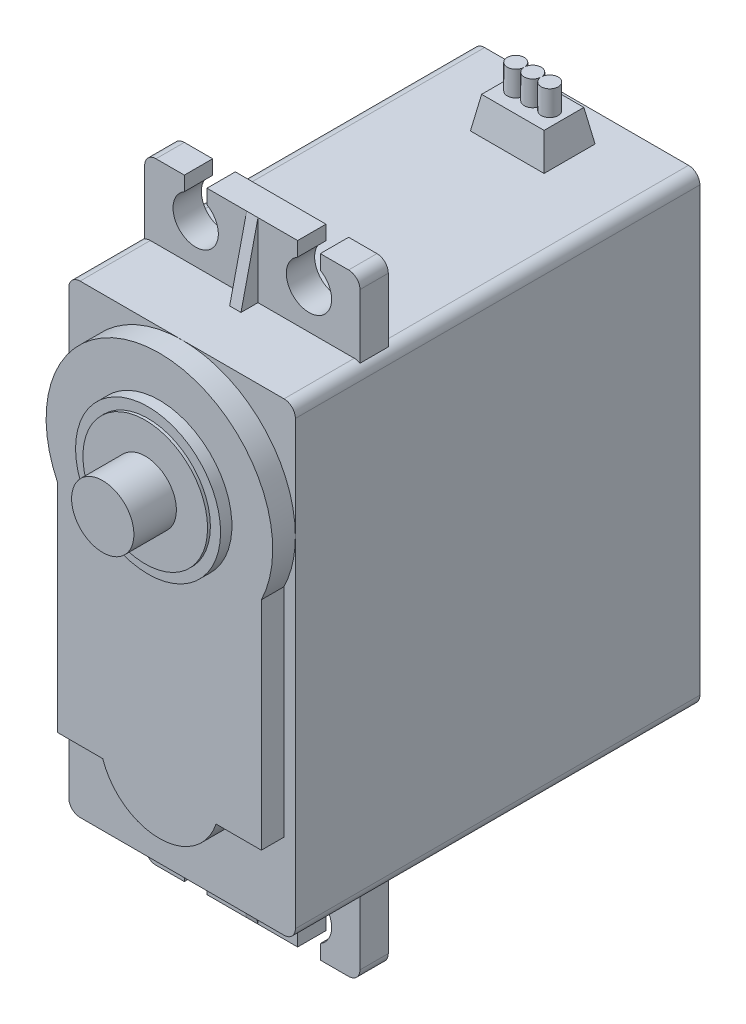
from build123d import *

# Parameters (mm, degrees)
ESQUISSE1_W              = 20
ESQUISSE1_H              = 41
BOSS_EXTRU_1_DEPTH       = 37.7
CONG_1_R                 = 1
BOSS_EXTRU_2_DEPTH       = 6.5
BOSS_EXTRU_2_DEPTH_BACK  = 47.5
ESQUISSE2_W              = 19
ESQUISSE2_H              = 2.5
ESQUISSE3_R              = 6.4
BOSS_EXTRU_3_DEPTH       = 1
ESQUISSE4_R              = 2.75
BOSS_EXTRU_4_DEPTH       = 4
ENL_V_MAT_EXTRU_1_DEPTH  = 4
ESQUISSE6_W              = 6.5
ESQUISSE6_H              = 4.5
BOSS_EXTRU_6_DEPTH       = 2.8
BOSS_EXTRU_6_TAPER       = 10
BOSS_EXTRU_12_DEPTH      = 2.2
BOSS_EXTRU_13_DEPTH      = 0.5
BOSS_EXTRU_13_DEPTH_BACK = 0.5
ESQUISSE8_W              = 34.833277075
ESQUISSE8_H              = 46.278938305
ENL_V_MAT_EXTRU_2_DEPTH  = 2
CONG_2_R                 = 1
ESQUISSE9_R              = 5.5
BOSS_EXTRU_14_DEPTH      = 0.25


with BuildPart() as part:
    # Esquisse1 → Boss.-Extru.1 (new body)
    with BuildSketch(Plane.XY):
        with Locations((10, 20.5)):
            Rectangle(ESQUISSE1_W, ESQUISSE1_H)
    extrude(amount=BOSS_EXTRU_1_DEPTH)

    # Congé1
    cong_1_edges = [part.edges().sort_by_distance(p)[0] for p in [
        (0, 41, 18.85),
        (20, 41, 18.85),
        (20, 0, 18.85),
        (0, 0, 18.85),
    ]]
    fillet(cong_1_edges, radius=CONG_1_R)

    # Esquisse2 → Boss.-Extru.2 (add, two sides: drawn at the far end of the back side and taken through both)
    with BuildSketch(Plane.XZ.offset(-BOSS_EXTRU_2_DEPTH_BACK)):
        with Locations((10, 28.25)):
            Rectangle(ESQUISSE2_W, ESQUISSE2_H)
    extrude(amount=BOSS_EXTRU_2_DEPTH + BOSS_EXTRU_2_DEPTH_BACK)

    # Esquisse3 → Boss.-Extru.3 (add)
    with BuildSketch(Plane.XY.offset(37.7)):
        with Locations(Location((10, 31, 0), (0, 0, 180))):
            Circle(ESQUISSE3_R)
    extrude(amount=BOSS_EXTRU_3_DEPTH)

    # Esquisse4 → Boss.-Extru.4 (add)
    with BuildSketch(Plane.XY.offset(38.7)):
        with Locations((10, 31)):
            Circle(ESQUISSE4_R)
    extrude(amount=BOSS_EXTRU_4_DEPTH)

    # Esquisse5 → Enlèv. mat.-Extru.1 (cut)
    with BuildSketch(Plane.XY.offset(29.5)):
        with BuildLine():
            ThreePointArc((16, 46.232050808), (15, 42.5), (14, 46.232050808))
            Line((14, 46.232050808), (14, 48.5))
            Line((14, 48.5), (16, 48.5))
            Line((16, 48.5), (16, 46.232050808))
        make_face()
        with BuildLine():
            Line((4, 48.5), (4, 46.232050808))
            ThreePointArc((4, 46.232050808), (5, 42.5), (6, 46.232050808))
            Line((6, 46.232050808), (6, 48.5))
            Line((6, 48.5), (4, 48.5))
        make_face()
        with BuildLine():
            Line((4, -6.5), (6, -6.5))
            Line((6, -6.5), (6, -5.232050808))
            ThreePointArc((6, -5.232050808), (5, -1.5), (4, -5.232050808))
            Line((4, -5.232050808), (4, -6.5))
        make_face()
        with BuildLine():
            Line((14, -6.5), (16, -6.5))
            Line((16, -6.5), (16, -5.232050808))
            ThreePointArc((16, -5.232050808), (15, -1.5), (14, -5.232050808))
            Line((14, -5.232050808), (14, -6.5))
        make_face()
    extrude(amount=-ENL_V_MAT_EXTRU_1_DEPTH, mode=Mode.SUBTRACT)

    # Esquisse6 → Boss.-Extru.6 (add)
    with BuildSketch(Plane(origin=(0, 41, 0), x_dir=(1, 0, 0), z_dir=(0, 1, 0))):
        with Locations((10, -4.75)):
            Rectangle(ESQUISSE6_W, ESQUISSE6_H)
    extrude(amount=BOSS_EXTRU_6_DEPTH, taper=BOSS_EXTRU_6_TAPER)

    # Esquisse7 → Boss.-Extru.12 (add)
    with BuildSketch(Plane(origin=(0, 43.8, 0), x_dir=(1, 0, 0), z_dir=(0, 1, 0))):
        with BuildLine():
            Line((10.751668523, -4.8), (10.748331477, -4.8))
            ThreePointArc((10.748331477, -4.8), (10, -5.5), (9.251668523, -4.8))
            Line((9.251668523, -4.8), (9.248331477, -4.8))
            ThreePointArc((9.248331477, -4.8), (7.75, -4.75), (9.248331477, -4.7))
            Line((9.248331477, -4.7), (9.251668523, -4.7))
            ThreePointArc((9.251668523, -4.7), (10, -4), (10.748331477, -4.7))
            Line((10.748331477, -4.7), (10.751668523, -4.7))
            ThreePointArc((10.751668523, -4.7), (12.25, -4.75), (10.751668523, -4.8))
        make_face()
    extrude(amount=BOSS_EXTRU_12_DEPTH)

    # Esquisse3D1 → Boss.-Extru.13 (add, two sides: drawn at the far end of the back side and taken through both)
    with BuildSketch(Plane(origin=(10, -6.5, 29.5), x_dir=(0, 1, 0), z_dir=(1, 0, 0)).offset(-BOSS_EXTRU_13_DEPTH_BACK)):
        Polygon((0, 0), (6.5, 0), (6.5, 1.5), align=None)
        Polygon((54, 0), (47.5, 0), (47.5, 1.5), align=None)
    extrude(amount=BOSS_EXTRU_13_DEPTH + BOSS_EXTRU_13_DEPTH_BACK)

    # Esquisse8 → Enlèv. mat.-Extru.2 (cut)
    with BuildSketch(Plane.XY.offset(37.7)):
        with Locations((11.272378628, 21.882709323)):
            Rectangle(ESQUISSE8_W, ESQUISSE8_H)
        with BuildLine():
            Line((1, 26.641101056), (1, 7.5))
            Line((1, 7.5), (5, 7.5))
            ThreePointArc((5, 7.5), (10, 3.896834669), (15, 7.5))
            Line((15, 7.5), (19, 7.5))
            Line((19, 7.5), (19, 26.641101056))
            ThreePointArc((19, 26.641101056), (10, 41), (1, 26.641101056))
        make_face(mode=Mode.SUBTRACT)
    extrude(amount=-ENL_V_MAT_EXTRU_2_DEPTH, mode=Mode.SUBTRACT)

    # Congé2
    cong_2_edges = [part.edges().sort_by_distance(p)[0] for p in [
        (0.5, 47.5, 28.25),
        (19.5, 47.5, 28.25),
        (0.5, -6.5, 28.25),
        (19.5, -6.5, 28.25),
    ]]
    fillet(cong_2_edges, radius=CONG_2_R)

    # Esquisse9 → Boss.-Extru.14 (add)
    with BuildSketch(Plane.XY.offset(38.7)):
        with Locations((10, 31)):
            Circle(ESQUISSE9_R)
    extrude(amount=BOSS_EXTRU_14_DEPTH)


solid = part.part
